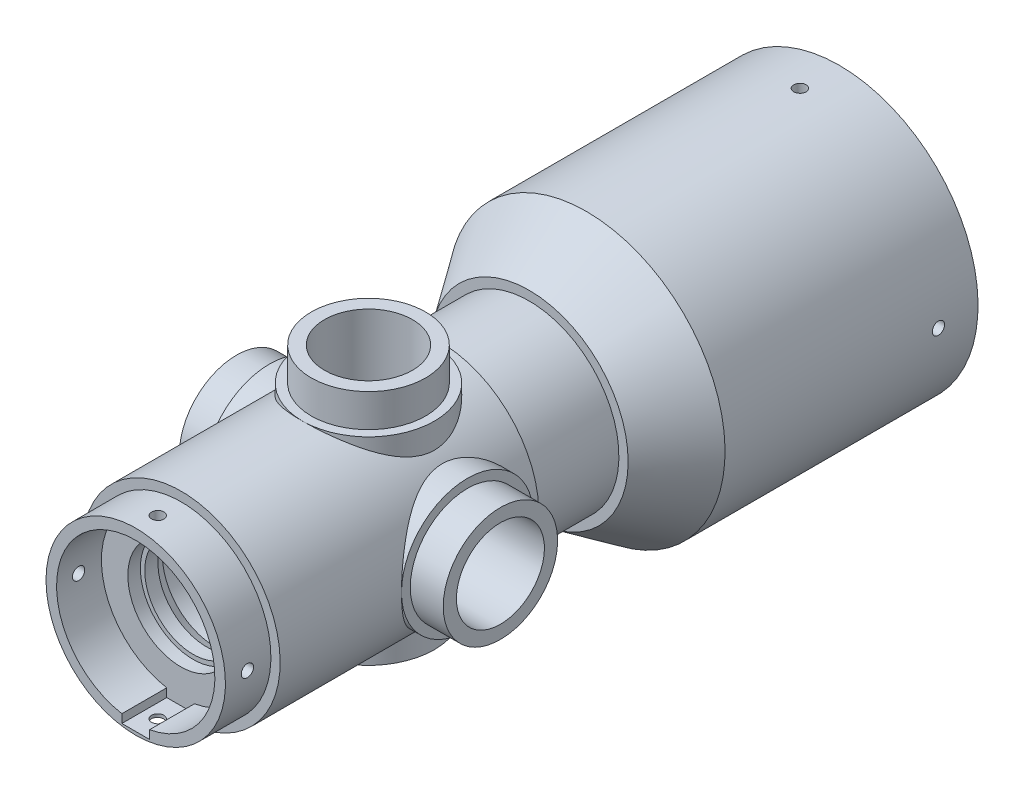
from build123d import *

# Parameters (mm, degrees)
SKETCH_2_R               = 10
CUT_EXTRUDE_1_DEPTH      = 30
SKETCH_3_R               = 13
SKETCH_3_R_2             = 10
EXTRUDE_1_DEPTH          = 7.5
SKETCH_4_W               = 20.3
SKETCH_4_H               = 2.1
SKETCH_5_R               = 15
SKETCH_5_R_2             = 13
EXTRUDE_2_DEPTH          = 6
CUT_EXTRUDE_2_DEPTH      = 30
SKETCH_7_W               = 2.8
SKETCH_7_H               = 2.2
EXTRUDE_3_DEPTH          = 27
CHAMFER_1_SIZE           = 1
PATTERN_CIRCULAR_1_COUNT = 2
PATTERN_CIRCULAR_1_ANGLE = 90
PATTERN_CIRCULAR_2_COUNT = 2
PATTERN_CIRCULAR_2_ANGLE = 90
SKETCH_8_W               = 100.689618136
SKETCH_8_H               = 76.036997766
CUT_EXTRUDE_3_DEPTH      = 167.089791244
SKETCH_10_R              = 12
CUT_EXTRUDE_4_DEPTH      = 10.2
SKETCH_14_R              = 1.4
CUT_EXTRUDE_5_DEPTH      = 254.940581151
PATTERN_CIRCULAR_3_COUNT = 2
PATTERN_CIRCULAR_3_ANGLE = 90
PATTERN_CIRCULAR_4_COUNT = 2
PATTERN_CIRCULAR_4_ANGLE = 180
SKETCH_15_R              = 13
SKETCH_15_R_2            = 10
EXTRUDE_4_DEPTH          = 5


with BuildPart() as part:
    # 스케치1 → 회전1 (revolve)
    with BuildSketch(Plane(origin=(0, 0, 0), x_dir=(0, 0, -1), z_dir=(1, 0, 0))):
        with BuildLine():
            Line((60, 26.5), (76.68415272, 26.5))
            Line((76.68415272, 26.5), (80.040551245, 22.5))
            Line((80.040551245, 22.5), (179.456997296, 22.5))
            Line((179.456997296, 22.5), (192.478422369, 31.510464574))
            Line((192.478422369, 31.510464574), (250, 31.510464574))
            Line((250, 31.510464574), (250, 29.510464574))
            Line((250, 29.510464574), (248.5, 29.510464574))
            Line((248.5, 29.510464574), (246.969886044, 25.5))
            Line((246.969886044, 25.5), (237.669886044, 25.5))
            ThreePointArc((237.669886044, 25.5), (237.373961668, 24.511481094), (237.169886044, 23.5))
            Line((237.169886044, 23.5), (233.169886044, 23.5))
            Line((233.169886044, 23.5), (228.378276293, 27.510464574))
            Line((228.378276293, 27.510464574), (192.478422369, 27.510464574))
            Line((192.478422369, 27.510464574), (179.456997296, 12))
            Line((179.456997296, 12), (108.051203169, 12))
            Line((108.051203169, 12), (106.051203169, 11))
            Line((106.051203169, 11), (103.051203169, 11))
            Line((103.051203169, 11), (103.051203169, 12))
            Line((103.051203169, 12), (78.851203169, 12))
            Line((78.851203169, 12), (78.851203169, 11))
            Line((78.851203169, 11), (75.851203169, 11))
            Line((75.851203169, 11), (65.671413176, 19))
            Line((65.671413176, 19), (3.195468814, 19))
            Line((3.195468814, 19), (2.019435822, 20.231096144))
            Line((2.019435822, 20.231096144), (0, 20.231096144))
            Line((0, 20.231096144), (0, 22.5))
            Line((0, 22.5), (60, 22.5))
            Line((60, 22.5), (60, 26.5))
        make_face()
    revolve(axis=Axis((0, 0, -250), (0, 0, 1)))

    # 스케치2 → 컷-돌출1 (cut)
    with BuildSketch(Plane(origin=(0, 0, 0), x_dir=(1, 0, 0), z_dir=(0, 1, 0))):
        with Locations(Location((0, 142.918222737, 0), (0, 0, 90))):
            Circle(SKETCH_2_R)
    cut_extrude_1 = extrude(amount=CUT_EXTRUDE_1_DEPTH, mode=Mode.SUBTRACT)

    # 스케치3 → 보스-돌출1 (add, symmetric)
    with BuildSketch(Plane(origin=(0, 22.5, 0), x_dir=(1, 0, 0), z_dir=(0, 1, 0))):
        with Locations(Location((0, 142.918222737, 0), (0, 0, 270))):
            Circle(SKETCH_3_R)
        with Locations(Location((0, 142.918222737, 0), (0, 0, 270))):
            Circle(SKETCH_3_R_2, mode=Mode.SUBTRACT)
    extrude_1 = extrude(amount=EXTRUDE_1_DEPTH, both=True)

    # 스케치4 → 컷-회전1 (revolve, cut)
    with BuildSketch(Plane(origin=(0, 0, 0), x_dir=(0, 0, -1), z_dir=(1, 0, 0)), mode=Mode.PRIVATE) as cut_revolve_1_sk:
        with Locations((169.306997296, 21.45)):
            Rectangle(SKETCH_4_W, SKETCH_4_H)
        Polygon((80.597298362, 22.5), (80.040551245, 20.4), (100.340551245, 20.4), (100.340551245, 22.5), align=None)
    revolve(cut_revolve_1_sk.sketch.rotate(Axis((0, 0, -250), (0, 0, -1)), 180), axis=Axis((0, 0, -250), (0, 0, -1)), mode=Mode.SUBTRACT)

    # 스케치5 → 보스-돌출2 (add)
    with BuildSketch(Plane(origin=(0, 22.5, 0), x_dir=(1, 0, 0), z_dir=(0, 1, 0))):
        with Locations((0, 142.918222737)):
            Circle(SKETCH_5_R)
        with Locations(Location((0, 142.918222737, 0), (0, 0, 270))):
            Circle(SKETCH_5_R_2, mode=Mode.SUBTRACT)
    extrude_2 = extrude(amount=-EXTRUDE_2_DEPTH)

    # 스케치6 → 컷-돌출2 (cut)
    with BuildSketch(Plane(origin=(0, 0, 0), x_dir=(1, 0, 0), z_dir=(0, 1, 0))):
        with BuildLine():
            Line((2.7, 53.666598612), (2.7, 35.300488004))
            ThreePointArc((2.7, 35.300488004), (0, 32.600488004), (-2.7, 35.300488004))
            Line((-2.7, 35.300488004), (-2.7, 53.666598612))
            ThreePointArc((-2.7, 53.666598612), (0, 56.366598612), (2.7, 53.666598612))
        make_face()
    extrude(amount=-CUT_EXTRUDE_2_DEPTH, mode=Mode.SUBTRACT)

    # 스케치7 → 보스-돌출3 (add)
    with BuildSketch(Plane.XY):
        with Locations((0, 22.5)):
            Rectangle(SKETCH_7_W, SKETCH_7_H)
    extrude(amount=-EXTRUDE_3_DEPTH)

    # 모따기1
    chamfer_1_edges = [part.edges().sort_by_distance(p)[0] for p in [
        (0, 23.6, -27),
        (0, 23.6, 0),
    ]]
    chamfer(chamfer_1_edges, length=CHAMFER_1_SIZE)

    # 원형 패턴1: 컷-돌출1, 보스-돌출1, 보스-돌출2 ×2 about axis
    pattern_circular_1_axis = Axis((0, 0, -65.671413176), (0, 0, -1))
    add([cut_extrude_1.rotate(pattern_circular_1_axis, i * PATTERN_CIRCULAR_1_ANGLE / (PATTERN_CIRCULAR_1_COUNT - 1)) for i in range(1, PATTERN_CIRCULAR_1_COUNT)], mode=Mode.SUBTRACT)
    add([extrude_1.rotate(pattern_circular_1_axis, i * PATTERN_CIRCULAR_1_ANGLE / (PATTERN_CIRCULAR_1_COUNT - 1)) for i in range(1, PATTERN_CIRCULAR_1_COUNT)])
    add([extrude_2.rotate(pattern_circular_1_axis, i * PATTERN_CIRCULAR_1_ANGLE / (PATTERN_CIRCULAR_1_COUNT - 1)) for i in range(1, PATTERN_CIRCULAR_1_COUNT)])

    # 원형 패턴2: 컷-돌출1, 보스-돌출1, 보스-돌출2 ×2 about axis
    pattern_circular_2_axis = Axis((0, 0, -250), (0, 0, 1))
    add([cut_extrude_1.rotate(pattern_circular_2_axis, i * PATTERN_CIRCULAR_2_ANGLE / (PATTERN_CIRCULAR_2_COUNT - 1)) for i in range(1, PATTERN_CIRCULAR_2_COUNT)], mode=Mode.SUBTRACT)
    add([extrude_1.rotate(pattern_circular_2_axis, i * PATTERN_CIRCULAR_2_ANGLE / (PATTERN_CIRCULAR_2_COUNT - 1)) for i in range(1, PATTERN_CIRCULAR_2_COUNT)])
    add([extrude_2.rotate(pattern_circular_2_axis, i * PATTERN_CIRCULAR_2_ANGLE / (PATTERN_CIRCULAR_2_COUNT - 1)) for i in range(1, PATTERN_CIRCULAR_2_COUNT)])

    # 스케치8 → 컷-돌출3 (cut, through all)
    with BuildSketch(Plane.XY.offset(-90)):
        Rectangle(SKETCH_8_W, SKETCH_8_H)
    extrude(amount=CUT_EXTRUDE_3_DEPTH, mode=Mode.SUBTRACT)

    # 스케치10 → 컷-돌출4 (cut)
    # profile 1 of 4: a face of its own
    with BuildSketch(Plane.XY.offset(-90)):
        with BuildLine():
            ThreePointArc((18, 0), (-11.560709321, 13.796738745), (-3.15, -17.722231801))
            Line((-3.15, -17.722231801), (-3.15, -16.35))
            Line((-3.15, -16.35), (3.15, -16.35))
            Line((3.15, -16.35), (3.15, -17.722231801))
            ThreePointArc((3.15, -17.722231801), (13.796738745, -11.560709321), (18, 0))
        make_face()
        with Locations(Location((0, 0, 0), (0, 0, 90))):
            Circle(SKETCH_10_R, mode=Mode.SUBTRACT)
    # profile 2 of 4: a face of its own
    with BuildSketch(Plane.XY.offset(-90)):
        with BuildLine():
            Line((-3.15, -16.35), (-3.15, -17.722231801))
            ThreePointArc((-3.15, -17.722231801), (0, -18), (3.15, -17.722231801))
            Line((3.15, -17.722231801), (3.15, -16.35))
            Line((3.15, -16.35), (-3.15, -16.35))
        make_face()
    # profile 3 of 4: a face of its own
    with BuildSketch(Plane.XY.offset(-90)):
        with BuildLine():
            Line((-3.15, -17.722231801), (-3.15, -19.65))
            Line((-3.15, -19.65), (3.15, -19.65))
            Line((3.15, -19.65), (3.15, -17.722231801))
            ThreePointArc((3.15, -17.722231801), (0, -18), (-3.15, -17.722231801))
        make_face()
    # profile 4 of 4: a face of its own
    with BuildSketch(Plane.XY.offset(-90)):
        with Locations(Location((0, 0, 0), (0, 0, 90))):
            Circle(SKETCH_10_R)
    extrude(amount=-CUT_EXTRUDE_4_DEPTH, mode=Mode.SUBTRACT)

    # 스케치14 → 컷-돌출5 (cut, symmetric)
    with BuildSketch(Plane(origin=(0, 0, 0), x_dir=(0, 0, -1), z_dir=(1, 0, 0))):
        with Locations((95, 0)):
            Circle(SKETCH_14_R)
        with Locations((241, 0)):
            Circle(SKETCH_14_R)
    cut_extrude_5 = extrude(amount=CUT_EXTRUDE_5_DEPTH, both=True, mode=Mode.SUBTRACT)

    # 원형 패턴3: 컷-돌출5 ×2 about axis
    pattern_circular_3_axis = Axis((0, 0, 0), (0, 0, -1))
    for i in range(1, PATTERN_CIRCULAR_3_COUNT):
        add(cut_extrude_5.rotate(pattern_circular_3_axis, i * PATTERN_CIRCULAR_3_ANGLE / (PATTERN_CIRCULAR_3_COUNT - 1)), mode=Mode.SUBTRACT)

    # 원형 패턴4: 컷-돌출1, 보스-돌출2 ×2 about axis
    pattern_circular_4_axis = Axis((0, 0, -250), (0, 0, -1))
    add([cut_extrude_1.rotate(pattern_circular_4_axis, i * PATTERN_CIRCULAR_4_ANGLE / (PATTERN_CIRCULAR_4_COUNT - 1)) for i in range(1, PATTERN_CIRCULAR_4_COUNT)], mode=Mode.SUBTRACT)
    add([extrude_2.rotate(pattern_circular_4_axis, i * PATTERN_CIRCULAR_4_ANGLE / (PATTERN_CIRCULAR_4_COUNT - 1)) for i in range(1, PATTERN_CIRCULAR_4_COUNT)])

    # 스케치15 → 보스-돌출4 (add)
    with BuildSketch(Plane.XZ.offset(22.5)):
        with Locations(Location((0, -142.918222737, 0), (0, 0, 90))):
            Circle(SKETCH_15_R)
        with Locations(Location((0, -142.918222737, 0), (0, 0, 90))):
            Circle(SKETCH_15_R_2, mode=Mode.SUBTRACT)
    extrude(amount=-EXTRUDE_4_DEPTH)


solid = part.part
